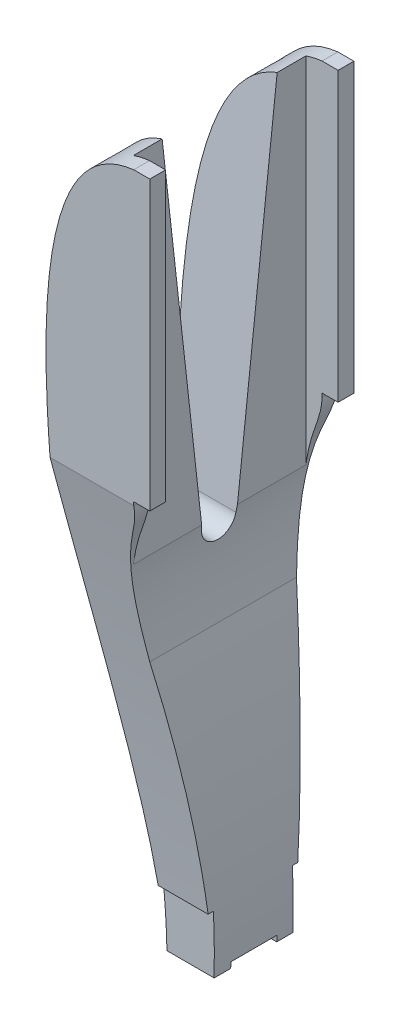
from build123d import *

# Parameters (mm, degrees)
BOSS_EXTRUDE2_DEPTH     = 35.5
CUT_EXTRUDE1_DEPTH      = 17.75
CUT_EXTRUDE2_DEPTH      = 2.8
SKETCH5_W               = 2.8
SKETCH5_H               = 2.75
BOSS_EXTRUDE3_DEPTH     = 50
CUT_EXTRUDE3_DEPTH      = 15
CUT_EXTRUDE4_DEPTH      = 126.902937834
CUT_EXTRUDE4_DEPTH_BACK = 126.902937834
SKETCH12_W              = 1.496855304
SKETCH12_H              = 10
SKETCH12_W_2            = 1.571931937
CUT_EXTRUDE5_DEPTH      = 20
CUT_EXTRUDE6_DEPTH      = 1


with BuildPart() as part:
    # Sketch1 → Boss-Extrude2 (new body)
    with BuildSketch(Plane.XY):
        with BuildLine():
            Line((5.6, 35.6), (5.6, -15))
            add(Edge.make_bspline(
                [(5.6, -15), (5.6, -17.274393969), (1.604195195, -25.847964508), (2.415841027, -35.113621235), (3.409417942, -42.11611418)],
                knots=[0, 0, 0, 0, 0.227789152, 0.921500182, 0.921500182, 0.921500182, 0.921500182], degree=3))
            add(Edge.make_bspline(
                [(3.409417942, -42.11611418), (14.021423643, -91.198515752), (3.540705721, -122.805120936)],
                knots=[0, 0, 0, 1, 1, 1], degree=2))
            Line((3.540705721, -122.805120936), (-4.088116427, -120.408076375))
            add(Edge.make_bspline(
                [(5.6, 35.6), (-12.367874994, 33.521263174), (-8.7823866, -50.782642202), (5.954211422, -91.451497422), (-4.088116427, -120.408076375)],
                knots=[0, 0, 0, 0, 0.40530679, 1, 1, 1, 1], degree=3))
        make_face()
    extrude(amount=BOSS_EXTRUDE2_DEPTH)

    # Sketch3 → Cut-Extrude1 (cut, symmetric)
    with BuildSketch(Plane(origin=(0, 0, 0), x_dir=(0, 0, -1), z_dir=(1, 0, 0))):
        with BuildLine():
            Line((0, -14.98237842), (29.62736343, -14.98237842))
            Line((29.62736343, -14.98237842), (29.62736343, -131.572481325))
            Line((29.62736343, -131.572481325), (-60.547074518, -131.572481325))
            Line((-60.547074518, -131.572481325), (-60.547074518, -14.98237842))
            Line((-60.547074518, -14.98237842), (-35.5, -14.98237842))
            add(Edge.make_bspline(
                [(-35.5, -14.98237842), (-28.308780975, -49.75857776), (-24.077993602, -85.166412163), (-22.769212626, -120.408076375)],
                knots=[0, 0, 0, 0, 1, 1, 1, 1], degree=3))
            Line((-22.769212626, -120.408076375), (-12.75, -120.408076375))
            add(Edge.make_bspline(
                [(0, -14.98237842), (-7.191219025, -49.75857776), (-11.441219025, -85.166412163), (-12.75, -120.408076375)],
                knots=[0, 0, 0, 0, 1, 1, 1, 1], degree=3))
        make_face()
    extrude(amount=CUT_EXTRUDE1_DEPTH, both=True, mode=Mode.SUBTRACT)

    # Sketch4 → Cut-Extrude2 (cut)
    with BuildSketch(Plane(origin=(5.6, 0, 0), x_dir=(0, 0, -1), z_dir=(1, 0, 0))):
        Polygon((-2.75, 35.6), (-32.75, 35.6), (-32.75, -15.000000007), (-32.75, -32.018147114), (-2.75, -32.018147114), (-2.75, -15.000000007), align=None)
    extrude(amount=-CUT_EXTRUDE2_DEPTH, mode=Mode.SUBTRACT)

    # Sketch5 → Boss-Extrude3 (add)
    with BuildSketch(Plane(origin=(0, 35.6, 0), x_dir=(1, 0, 0), z_dir=(0, 1, 0))):
        with Locations((7, -1.375)):
            Rectangle(SKETCH5_W, SKETCH5_H)
        with Locations((7, -34.125)):
            Rectangle(SKETCH5_W, SKETCH5_H)
    extrude(amount=-BOSS_EXTRUDE3_DEPTH)

    # Sketch6 → Cut-Extrude3 (cut, symmetric)
    with BuildSketch(Plane(origin=(0, 0, 0), x_dir=(0, 0, -1), z_dir=(1, 0, 0))):
        with BuildLine():
            Line((-7.75, 34.96933844), (-14.781773193, -27.808788024))
            ThreePointArc((-14.781773193, -27.808788024), (-17.763748777, -30.474846509), (-20.744622729, -27.807556366))
            Line((-20.744622729, -27.807556366), (-27.75, 34.96933844))
            Line((-27.75, 34.96933844), (-7.75, 34.96933844))
        make_face()
    extrude(amount=CUT_EXTRUDE3_DEPTH, both=True, mode=Mode.SUBTRACT)

    # Sketch12 → Cut-Extrude4 (cut, two sides: drawn at the far end of the back side and taken through both)
    with BuildSketch(Plane(origin=(0, 0, 0), x_dir=(0, 0, -1), z_dir=(1, 0, 0)).offset(-CUT_EXTRUDE4_DEPTH_BACK)):
        with Locations((-10.144277768, -85)):
            Rectangle(SKETCH12_W, SKETCH12_H)
        with Locations((-25.408624424, -85)):
            Rectangle(SKETCH12_W_2, SKETCH12_H)
    extrude(amount=CUT_EXTRUDE4_DEPTH + CUT_EXTRUDE4_DEPTH_BACK, mode=Mode.SUBTRACT)

    # Sketch14 → Cut-Extrude5 (cut)
    with BuildSketch(Plane(origin=(0, 0, 10.89270542), x_dir=(-1, 0, 0), z_dir=(0, 0, -1))):
        Polygon((-8.720315384, -90), (6.272671273, -90), (6.272671273, -124.093634091), (-10.541100015, -124.093634091), (-10.541100015, -90), align=None)
    extrude(amount=-CUT_EXTRUDE5_DEPTH, mode=Mode.SUBTRACT)

    # Sketch15 → Cut-Extrude6 (cut)
    with BuildSketch(Plane(origin=(0, -90, 0), x_dir=(-1, 0, 0), z_dir=(0, -1, 0))):
        with BuildLine():
            Line((-5.220315384, -13.74270542), (-8.720315384, -13.74270542))
            Line((-8.720315384, -13.74270542), (-9.623354914, -13.74270542))
            Line((-9.623354914, -13.74270542), (-9.623354914, -21.74270542))
            Line((-9.623354914, -21.74270542), (-5.220315384, -21.74270542))
            ThreePointArc((-5.220315384, -21.74270542), (-1.220315384, -17.74270542), (-5.220315384, -13.74270542))
        make_face()
    extrude(amount=-CUT_EXTRUDE6_DEPTH, mode=Mode.SUBTRACT)


solid = part.part
